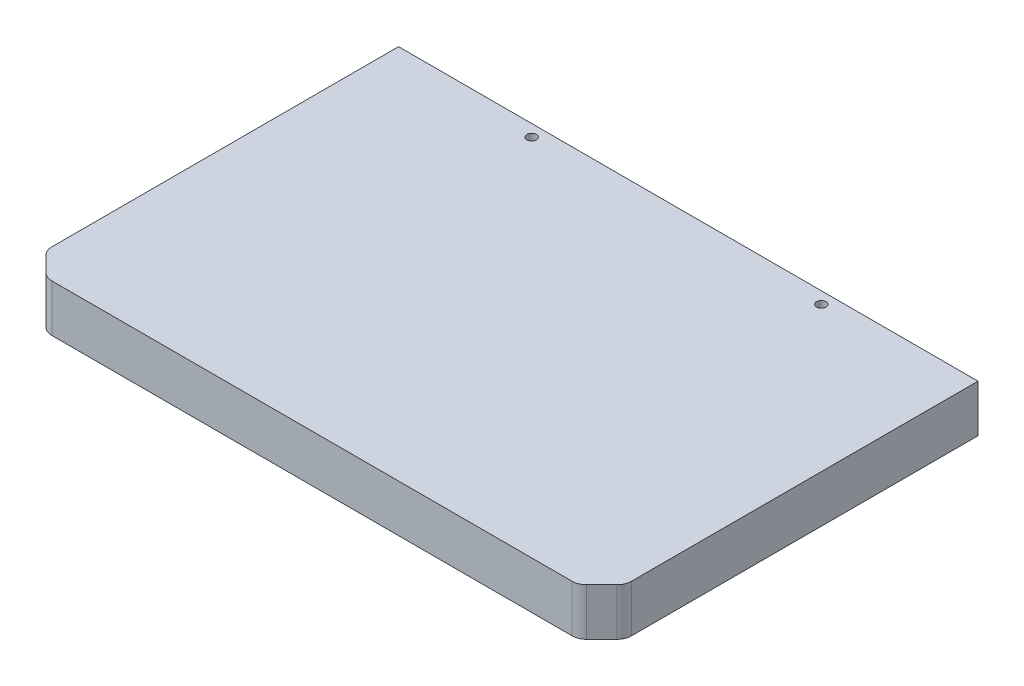
from build123d import *

# Parameters (mm, degrees)
SKETCH2_R           = 1
BOSS_EXTRUDE1_DEPTH = 10


with BuildPart() as part:
    # Sketch2 → Boss-Extrude1 (new body)
    with BuildSketch(Plane(origin=(0, 0, 0), x_dir=(1, 0, 0), z_dir=(0, 1, 0))):
        with BuildLine():
            Line((-61.25, 44.29), (-61.25, -29.007359313))
            ThreePointArc((-61.25, -29.007359313), (-61.021638598, -30.15540961), (-60.371320344, -31.128679656))
            Line((-60.371320344, -31.128679656), (-57.128679656, -34.371320344))
            ThreePointArc((-57.128679656, -34.371320344), (-56.15540961, -35.021638598), (-55.007359313, -35.25))
            Line((-55.007359313, -35.25), (55.007359313, -35.25))
            ThreePointArc((55.007359313, -35.25), (56.15540961, -35.021638598), (57.128679656, -34.371320344))
            Line((57.128679656, -34.371320344), (60.371320344, -31.128679656))
            ThreePointArc((60.371320344, -31.128679656), (61.021638598, -30.15540961), (61.25, -29.007359313))
            Line((61.25, -29.007359313), (61.25, 44.29))
            Line((61.25, 44.29), (-61.25, 44.29))
        make_face()
        with Locations(Location((-30.625, 41.79, 0), (0, 0, 270))):
            Circle(SKETCH2_R, mode=Mode.SUBTRACT)
        with Locations(Location((30.625, 41.79, 0), (0, 0, 270))):
            Circle(SKETCH2_R, mode=Mode.SUBTRACT)
    extrude(amount=BOSS_EXTRUDE1_DEPTH)


solid = part.part
